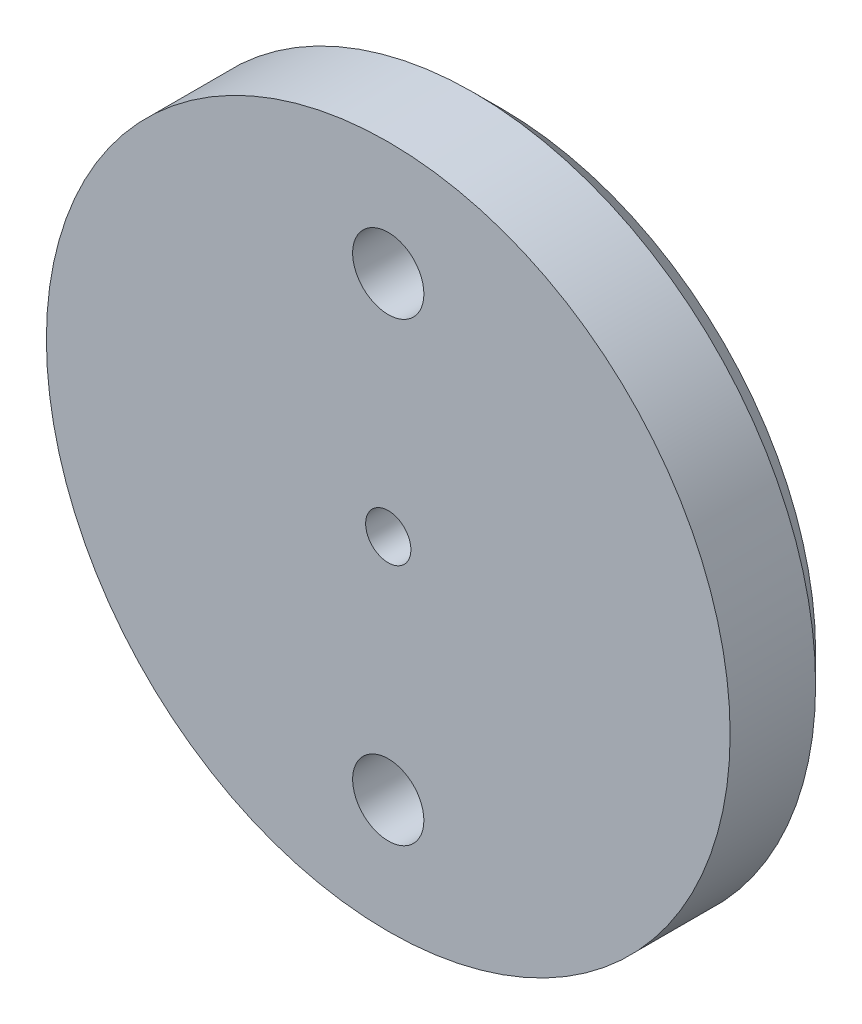
from build123d import *

# Parameters (mm, degrees)
TAP_DRILL_FOR_M3X0_5_TAP1_D = 2.5
CHAMFER1_SIZE               = 1
FILLET1_R                   = 0.5
FILLET2_R                   = 0.15


with BuildPart() as part:
    # Sketch1 → Revolve1 (revolve)
    with BuildSketch(Plane(origin=(0, 0, 0), x_dir=(1, 0, 0), z_dir=(0, 1, 0))):
        Polygon((0.79375, 0), (12, 0), (12, 4), (1.5875, 4), (1.5875, 8), (2, 8), (1.464101615, 10), (0.79375, 10), align=None)
    revolve(axis=Axis((0, 0, 0), (0, 0, -1)))

    # Tap Drill for M3x0.5 Tap1 (through all)
    with Locations(Plane.XY):
        with Locations((0, 8), (0, -8)):
            Hole(TAP_DRILL_FOR_M3X0_5_TAP1_D / 2)

    # Chamfer1
    chamfer1_edges = [part.edges().sort_by_distance(p)[0] for p in [
        (-12, 0, -4),
    ]]
    chamfer(chamfer1_edges, length=CHAMFER1_SIZE)

    # Fillet1
    fillet1_edges = [part.edges().sort_by_distance(p)[0] for p in [
        (-1.464101615, 0, -10),
        (-1.5875, 0, -4),
    ]]
    fillet(fillet1_edges, radius=FILLET1_R)

    # Fillet2
    fillet2_edges = [part.edges().sort_by_distance(p)[0] for p in [
        (-2, 0, -8),
        (-1.5875, 0, -8),
    ]]
    fillet(fillet2_edges, radius=FILLET2_R)


solid = part.part
